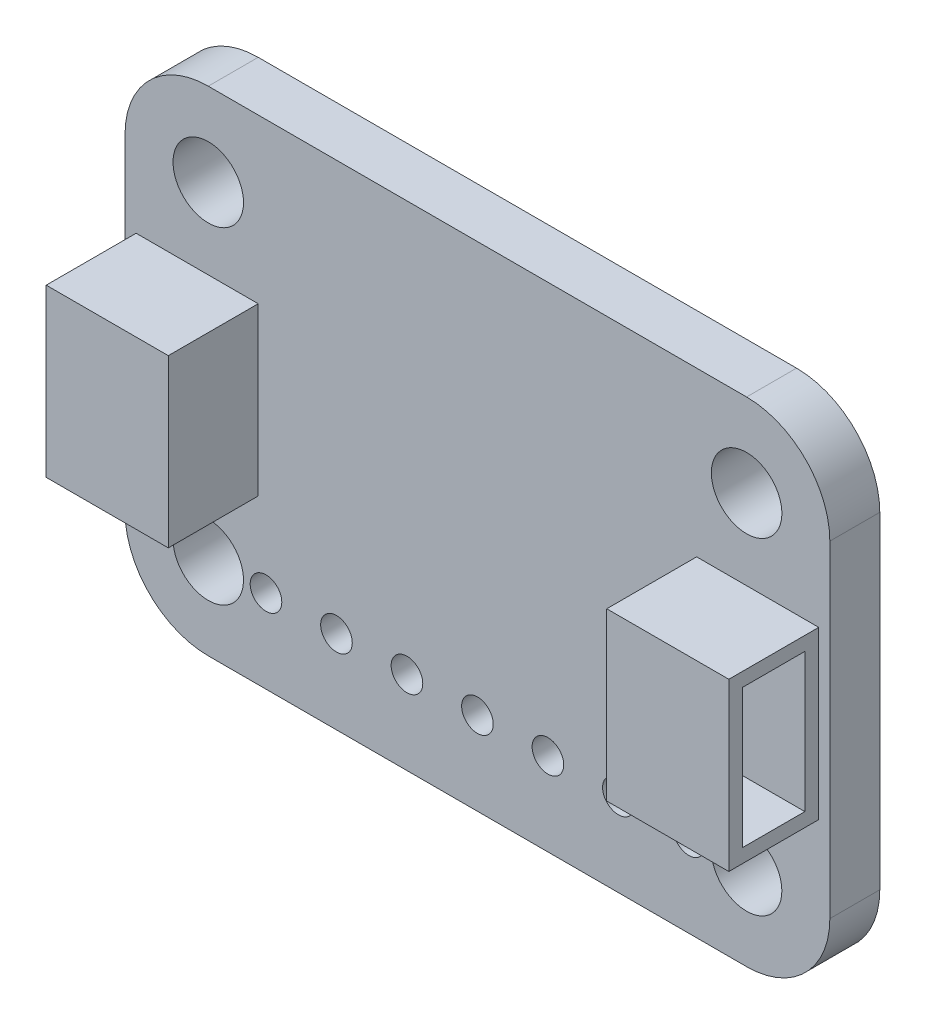
from build123d import *

# Parameters (mm, degrees)
CROQUIS1_R              = 1.27
CROQUIS1_R_2            = 0.57
SALIENTE_EXTRUIR1_DEPTH = 1.8
CROQUIS2_W              = 4.4
CROQUIS2_H              = 6
SALIENTE_EXTRUIR2_DEPTH = 3.24
CROQUIS3_W              = 2.24
CROQUIS3_H              = 5
CORTAR_EXTRUIR2_DEPTH   = 3.9
CORTAR_EXTRUIR3_START   = -24.6
CROQUIS3_3_W            = 2.24
CROQUIS3_3_H            = 5
CORTAR_EXTRUIR3_DEPTH   = 3.9


with BuildPart() as part:
    # Croquis1 → Saliente-Extruir1 (new body)
    with BuildSketch(Plane.XY):
        with BuildLine():
            Line((9.7, -8.89), (-9.7, -8.89))
            ThreePointArc((-9.7, -8.89), (-11.821320344, -8.011320344), (-12.7, -5.89))
            Line((-12.7, -5.89), (-12.7, 5.89))
            ThreePointArc((-12.7, 5.89), (-11.821320344, 8.011320344), (-9.7, 8.89))
            Line((-9.7, 8.89), (9.7, 8.89))
            ThreePointArc((9.7, 8.89), (11.821320344, 8.011320344), (12.7, 5.89))
            Line((12.7, 5.89), (12.7, -5.89))
            ThreePointArc((12.7, -5.89), (11.821320344, -8.011320344), (9.7, -8.89))
        make_face()
        with Locations((-9.7, 5.89)):
            Circle(CROQUIS1_R, mode=Mode.SUBTRACT)
        with Locations(Location((9.7, 5.89, 0), (0, 0, 180))):
            Circle(CROQUIS1_R, mode=Mode.SUBTRACT)
        with Locations((9.7, -5.89)):
            Circle(CROQUIS1_R, mode=Mode.SUBTRACT)
        with Locations(Location((-9.7, -5.89, 0), (0, 0, 180))):
            Circle(CROQUIS1_R, mode=Mode.SUBTRACT)
        with Locations((-7.62, -5.89)):
            Circle(CROQUIS1_R_2, mode=Mode.SUBTRACT)
        with Locations((-5.08, -5.89)):
            Circle(CROQUIS1_R_2, mode=Mode.SUBTRACT)
        with Locations((-2.54, -5.89)):
            Circle(CROQUIS1_R_2, mode=Mode.SUBTRACT)
        with Locations((0, -5.89)):
            Circle(CROQUIS1_R_2, mode=Mode.SUBTRACT)
        with Locations((2.54, -5.89)):
            Circle(CROQUIS1_R_2, mode=Mode.SUBTRACT)
        with Locations((5.08, -5.89)):
            Circle(CROQUIS1_R_2, mode=Mode.SUBTRACT)
        with Locations((7.62, -5.89)):
            Circle(CROQUIS1_R_2, mode=Mode.SUBTRACT)
    extrude(amount=SALIENTE_EXTRUIR1_DEPTH)

    # Croquis2 → Saliente-Extruir2 (add)
    with BuildSketch(Plane.XY.offset(1.8)):
        with Locations((-10.1, 0)):
            Rectangle(CROQUIS2_W, CROQUIS2_H)
        with Locations((10.1, 0)):
            Rectangle(CROQUIS2_W, CROQUIS2_H)
    extrude(amount=SALIENTE_EXTRUIR2_DEPTH)

    # Croquis3 → Cortar-Extruir2 (cut)
    with BuildSketch(Plane(origin=(12.3, 0, 0), x_dir=(0, 0, -1), z_dir=(1, 0, 0))):
        with Locations((-3.42, 0)):
            Rectangle(CROQUIS3_W, CROQUIS3_H)
    extrude(amount=-CORTAR_EXTRUIR2_DEPTH, mode=Mode.SUBTRACT)

    # Croquis3<3> → Cortar-Extruir3 (cut)
    with BuildSketch(Plane(origin=(12.3, 0, 0), x_dir=(0, 0, -1), z_dir=(1, 0, 0)).offset(CORTAR_EXTRUIR3_START)):
        with Locations((-3.42, 0)):
            Rectangle(CROQUIS3_3_W, CROQUIS3_3_H)
    extrude(amount=CORTAR_EXTRUIR3_DEPTH, mode=Mode.SUBTRACT)


solid = part.part
